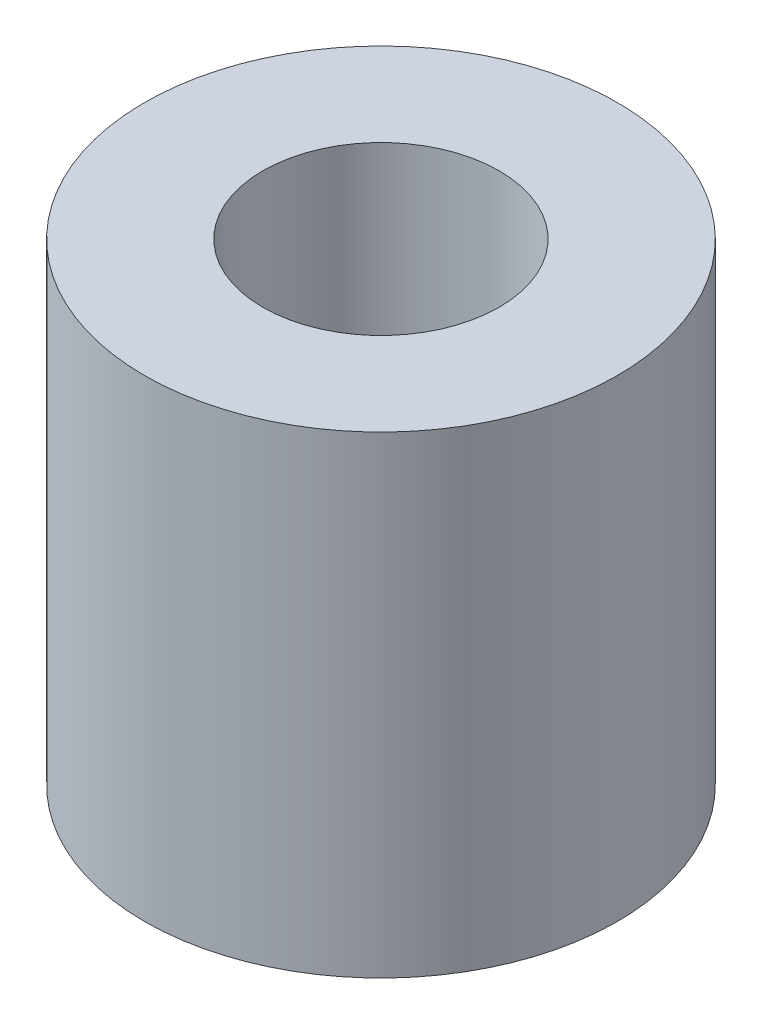
from build123d import *

# Parameters (mm, degrees)
SKETCH1_R           = 2
SKETCH1_R_2         = 1
BOSS_EXTRUDE1_DEPTH = 4


with BuildPart() as part:
    # Sketch1 → Boss-Extrude1 (new body)
    with BuildSketch(Plane(origin=(0, 0, 0), x_dir=(1, 0, 0), z_dir=(0, 1, 0))):
        with Locations(Location((0, 0, 0), (0, 0, 270))):
            Circle(SKETCH1_R)
        with Locations(Location((0, 0, 0), (0, 0, 270))):
            Circle(SKETCH1_R_2, mode=Mode.SUBTRACT)
    extrude(amount=BOSS_EXTRUDE1_DEPTH)


solid = part.part
